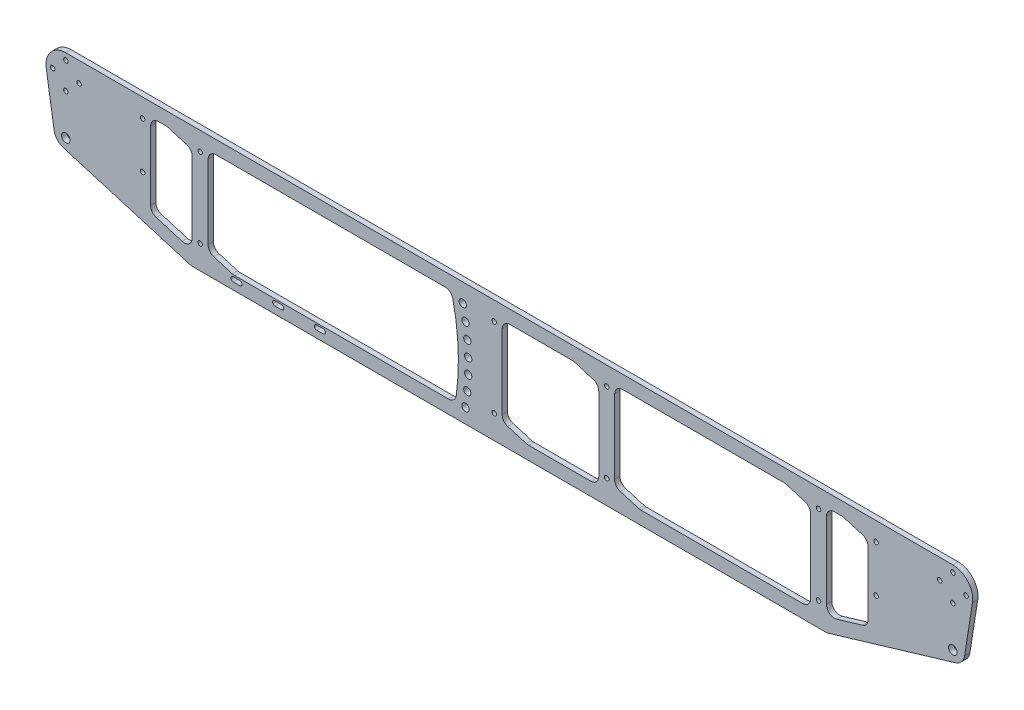
from build123d import *

# Parameters (mm, degrees)
SKETCH_1_R          = 3.25
EXTRUDE_1_DEPTH     = 4
HOLE_WIZARD_M32_D   = 3.4
HOLE_WIZARD_M52_D   = 5.5
HOLE_WIZARD_M53_D   = 5.5
FILLET_5_R          = 10
CUT_EXTRUDE_4_DEPTH = 354.032576401
FILLET_7_R          = 6
HOLE_WIZARD_M34_D   = 3.4
CUT_EXTRUDE_5_DEPTH = 354.032576401


with BuildPart() as part:
    # Эскиз1 → Бобышка-Вытянуть1 (new body)
    with BuildSketch(Plane.XY):
        with BuildLine():
            Line((-349.818316726, 28.672449915), (-342.910885265, -15.303620822))
            Line((-342.910885265, -15.303620822), (-240, -46))
            Line((-240, -46), (240, -46))
            Line((240, -46), (342.910885265, -15.303620822))
            Line((342.910885265, -15.303620822), (349.818316726, 28.672449915))
            ThreePointArc((349.818316726, 28.672449915), (346.399852001, 40.749019149), (335, 46))
            Line((335, 46), (-335, 46))
            ThreePointArc((-335, 46), (-346.399852001, 40.749019149), (-349.818316726, 28.672449915))
        make_face()
        with Locations((-335, -9.635315981)):
            Circle(SKETCH_1_R, mode=Mode.SUBTRACT)
        with Locations(Location((335, -9.635315981, 0), (0, 0, 180))):
            Circle(SKETCH_1_R, mode=Mode.SUBTRACT)
    extrude(amount=EXTRUDE_1_DEPTH)

    # Отверстие с зазором M32 (through all)
    with Locations(Plane.XY.offset(4)):
        with Locations((-335, 41), (-345, 31), (-335, 21), (-325, 31), (325, 31), (335, 41), (345, 31), (335, 21)):
            Hole(HOLE_WIZARD_M32_D / 2)

    # Отверстие с зазором M52 (through all)
    with Locations(Plane(origin=(0, 0, 0), x_dir=(-1, 0, 0), z_dir=(0, 0, -1))):
        with Locations((215, -7)):
            Hole(HOLE_WIZARD_M52_D / 2)

    # Отверстие с зазором M53 (through all)
    with Locations(Plane(origin=(0, 0, 0), x_dir=(-1, 0, 0), z_dir=(0, 0, -1))):
        with Locations((31.771314746, 9.83), (35.189476411, 32.040691677), (33.141482074, 20.990703059), (31.085819286, -1.380913569), (31.085819286, -12.619086431), (31.771893326, -23.836297834), (33.141482074, -34.990703059)):
            Hole(HOLE_WIZARD_M53_D / 2)

    # Скругление5
    fillet_5_edges = [part.edges().sort_by_distance(p)[0] for p in [
        (342.910885265, -15.303620822, 2),
        (240, -46, 2),
        (-240, -46, 2),
        (-342.910885265, -15.303620822, 2),
    ]]
    fillet(fillet_5_edges, radius=FILLET_5_R)

    # Эскиз22 → Вырез-Вытянуть4 (cut, through all)
    with BuildSketch(Plane(origin=(0, 0, 0), x_dir=(-1, 0, 0), z_dir=(0, 0, -1))):
        Polygon((-227.540368898, -36), (-98.70593747, -36), (-79.540368898, -30.283271798), (-79.540368898, 36), (-208.374800326, 36), (-227.540368898, 30.283271798), align=None)
        with BuildLine():
            Line((227.54, -30.283271798), (208.374431428, -36))
            Line((208.374431428, -36), (40.898736363, -36))
            ThreePointArc((40.898736363, -36), (38.644905491, 0.150569256), (43.818079226, 36))
            Line((43.818079226, 36), (227.54, 36))
            Line((227.54, 36), (227.54, -30.283271798))
        make_face()
        Polygon((-271, 30.283271798), (-251.834431428, 36), (-239.540368898, 36), (-239.540368898, -35.701718831), (-271, -26.317903284), align=None)
        Polygon((-67.540368898, -36), (-13.70593747, -36), (5.459631102, -30.283271798), (5.459631102, 36), (-48.374800326, 36), (-67.540368898, 30.283271798), align=None)
        Polygon((239.54, 30.283271798), (258.705568572, 36), (271, 36), (271, -26.317903284), (239.54, -35.701828866), align=None)
    extrude(amount=-CUT_EXTRUDE_4_DEPTH, mode=Mode.SUBTRACT)

    # Скругление7
    fillet_7_edges = [part.edges().sort_by_distance(p)[0] for p in [
        (227.540368898, -36, 2),
        (227.540368898, 30.283271798, 2),
        (208.374800326, 36, 2),
        (79.540368898, 36, 2),
        (79.540368898, -30.283271798, 2),
        (98.70593747, -36, 2),
        (271, -26.317903284, 2),
        (271, 30.283271798, 2),
        (251.834431428, 36, 2),
        (239.540368898, 36, 2),
        (239.540368898, -35.701718831, 2),
        (-40.898736363, -36, 2),
        (-43.818079226, 36, 2),
        (-227.54, 36, 2),
        (-227.54, -30.283271798, 2),
        (-208.374431428, -36, 2),
        (67.540368898, -36, 2),
        (67.540368898, 30.283271798, 2),
        (48.374800326, 36, 2),
        (-5.459631102, 36, 2),
        (-5.459631102, -30.283271798, 2),
        (13.70593747, -36, 2),
        (-271, -26.317903284, 2),
        (-239.54, -35.701828866, 2),
        (-239.54, 30.283271798, 2),
        (-258.705568572, 36, 2),
        (-271, 36, 2),
    ]]
    fillet(fillet_7_edges, radius=FILLET_7_R)

    # Отверстие с зазором M34 (through all)
    with Locations(Plane(origin=(0, 0, 0), x_dir=(-1, 0, 0), z_dir=(0, 0, -1))):
        with Locations((-233.540368898, 32), (-233.540368898, -28), (-73.540368898, -28), (-73.540368898, 32), (11.459631102, 32), (11.459631102, -28), (277, 32), (277, -3), (-277, 32), (-277, -3), (233.54, -28), (233.54, 32)):
            Hole(HOLE_WIZARD_M34_D / 2)

    # Эскиз25 → Вырез-Вытянуть5 (cut, through all)
    with BuildSketch(Plane.XY.offset(4)):
        with BuildLine():
            Line((-208.641482074, -37.3), (-203.641482074, -37.3))
            ThreePointArc((-203.641482074, -37.3), (-201.941482074, -39), (-203.641482074, -40.7))
            Line((-203.641482074, -40.7), (-208.641482074, -40.7))
            ThreePointArc((-208.641482074, -40.7), (-210.341482074, -39), (-208.641482074, -37.3))
        make_face()
        with BuildLine():
            Line((-177.141482074, -37.3), (-172.141482074, -37.3))
            ThreePointArc((-172.141482074, -37.3), (-170.441482074, -39), (-172.141482074, -40.7))
            Line((-172.141482074, -40.7), (-177.141482074, -40.7))
            ThreePointArc((-177.141482074, -40.7), (-178.841482074, -39), (-177.141482074, -37.3))
        make_face()
        with BuildLine():
            Line((-140.641482074, -40.7), (-145.641482074, -40.7))
            ThreePointArc((-145.641482074, -40.7), (-147.341482074, -39), (-145.641482074, -37.3))
            Line((-145.641482074, -37.3), (-140.641482074, -37.3))
            ThreePointArc((-140.641482074, -37.3), (-138.941482074, -39), (-140.641482074, -40.7))
        make_face()
    extrude(amount=-CUT_EXTRUDE_5_DEPTH, mode=Mode.SUBTRACT)


solid = part.part
